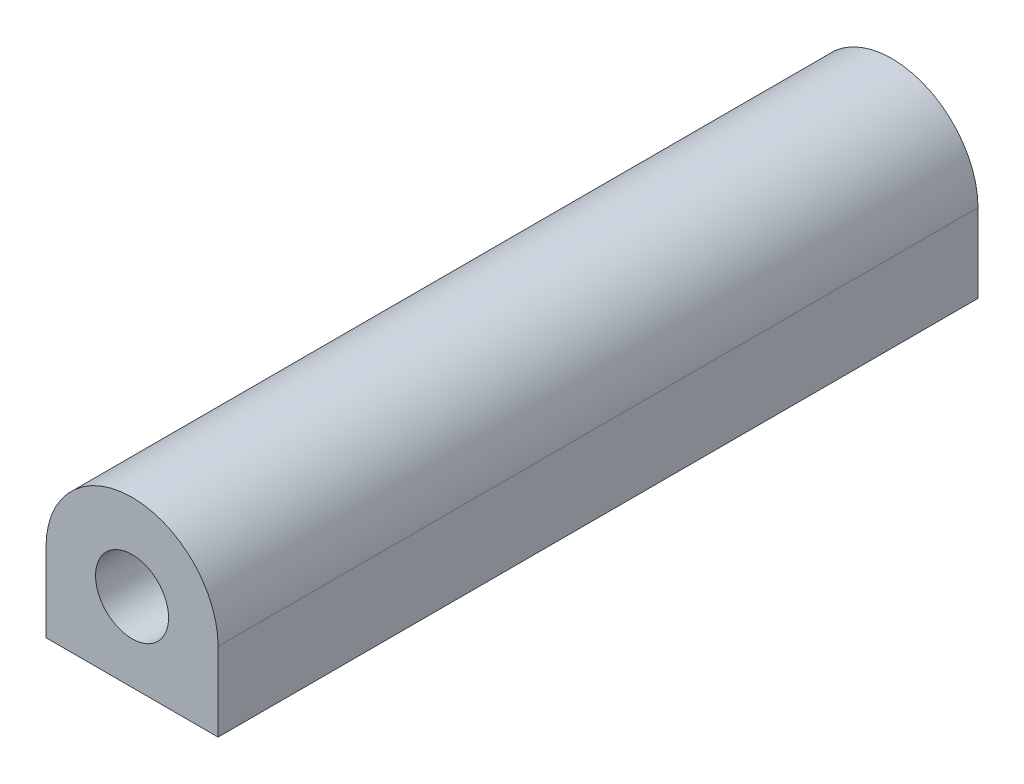
from build123d import *

# Parameters (mm, degrees)
SKETCH2_R           = 3.475
BOSS_EXTRUDE2_DEPTH = 30.6846
SKETCH3_R           = 1.475
CUT_EXTRUDE1_DEPTH  = 10
CUT_EXTRUDE2_START  = -10
SKETCH4_R           = 1.475
CUT_EXTRUDE2_DEPTH  = 10
BOSS_EXTRUDE3_DEPTH = 30.6846
SKETCH6_W           = 6.95
SKETCH6_H           = 30.6846
CUT_EXTRUDE3_DEPTH  = 0.3


with BuildPart() as part:
    # Sketch2 → Boss-Extrude2 (new body)
    with BuildSketch(Plane.XY):
        Circle(SKETCH2_R)
    extrude(amount=BOSS_EXTRUDE2_DEPTH)

    # Sketch3 → Cut-Extrude1 (cut)
    with BuildSketch(Plane.XY.offset(30.6846)):
        Circle(SKETCH3_R)
    extrude(amount=-CUT_EXTRUDE1_DEPTH, mode=Mode.SUBTRACT)

    # Sketch4 → Cut-Extrude2 (cut)
    with BuildSketch(Plane(origin=(0, 0, 0), x_dir=(-1, 0, 0), z_dir=(0, 0, -1)).offset(CUT_EXTRUDE2_START)):
        with Locations(Location((0, 0, 0), (0, 0, 180))):
            Circle(SKETCH4_R)
    extrude(amount=CUT_EXTRUDE2_DEPTH, mode=Mode.SUBTRACT)

    # Sketch5 → Boss-Extrude3 (add)
    with BuildSketch(Plane(origin=(0, 0, 0), x_dir=(-1, 0, 0), z_dir=(0, 0, -1))):
        with BuildLine():
            ThreePointArc((0, -3.475), (-2.457196065, -2.457196065), (-3.475, 0))
            Line((-3.475, 0), (-3.475, -3.475))
            Line((-3.475, -3.475), (0, -3.475))
        make_face()
        with BuildLine():
            Line((3.475, -3.475), (3.475, 0))
            ThreePointArc((3.475, 0), (2.457196065, -2.457196065), (0, -3.475))
            Line((0, -3.475), (3.475, -3.475))
        make_face()
    extrude(amount=-BOSS_EXTRUDE3_DEPTH)

    # Sketch6 → Cut-Extrude3 (cut)
    with BuildSketch(Plane(origin=(0, -3.475, 0), x_dir=(-1, 0, 0), z_dir=(0, -1, 0))):
        with Locations((0, -15.3423)):
            Rectangle(SKETCH6_W, SKETCH6_H)
    extrude(amount=-CUT_EXTRUDE3_DEPTH, mode=Mode.SUBTRACT)


solid = part.part
